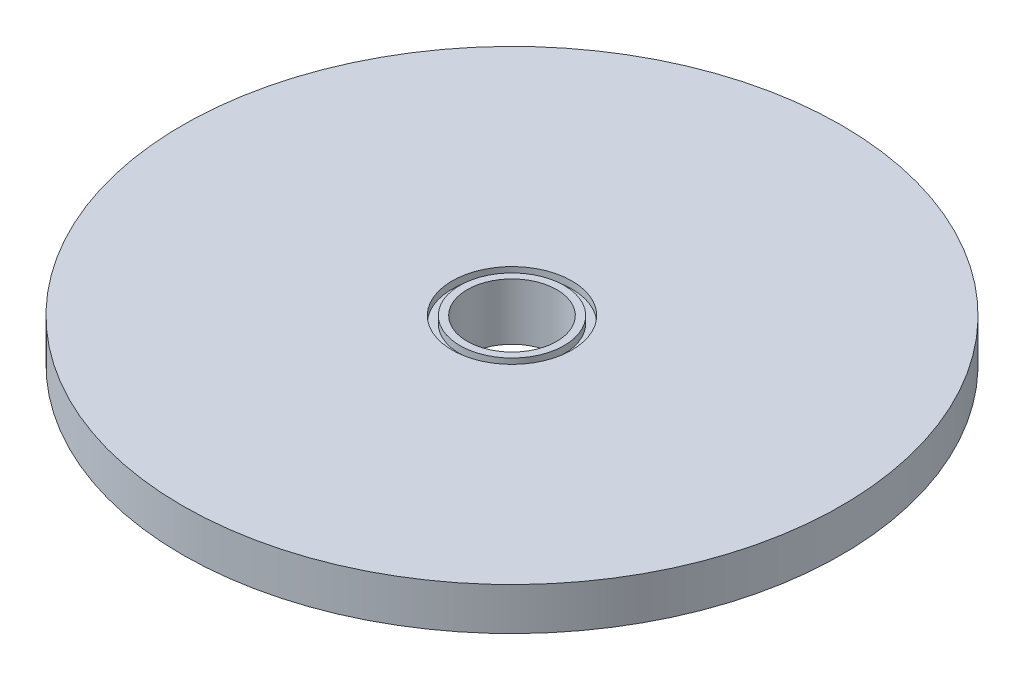
from build123d import *


with BuildPart() as part:
    # Sketch3 → Revolve1 (revolve)
    with BuildSketch(Plane.XY, mode=Mode.PRIVATE) as revolve1_sk:
        Polygon((-47.57, 0), (-9.4967, 0), (-9.4967, 12), (-11.049, 12), (-11.049, 10.5), (-12.7, 10.5), (-12.7, 12), (-69.85, 12), (-69.85, 3), (-47.57, 3), align=None)
    revolve(revolve1_sk.sketch.rotate(Axis((0, 0, 0), (0, 1, 0)), 270), axis=Axis((0, 0, 0), (0, 1, 0)))


solid = part.part
